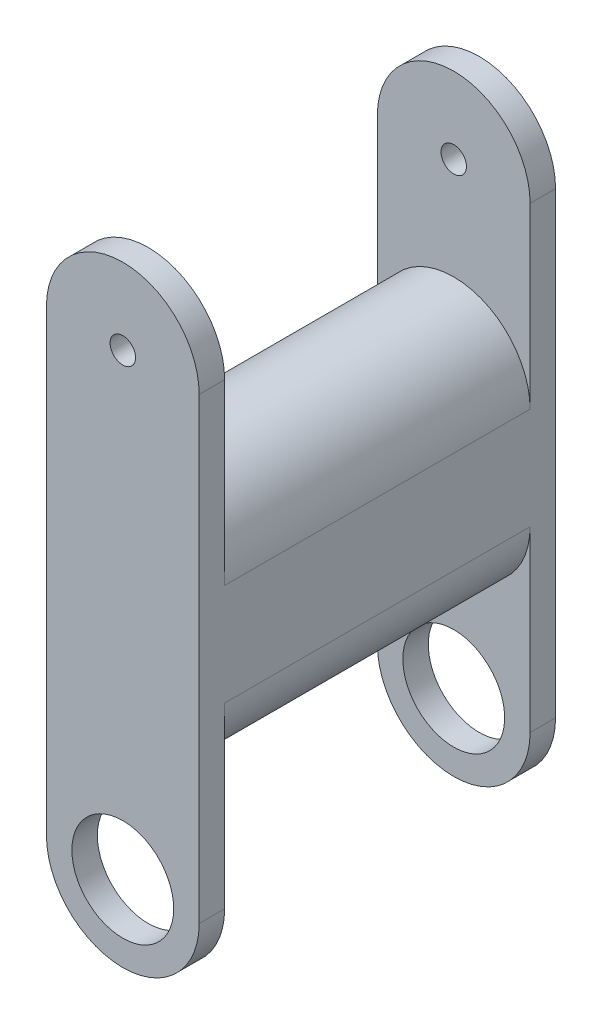
from build123d import *

# Parameters (mm, degrees)
SKETCH_1_R          = 10
SKETCH_1_R_2        = 2.5
EXTRUDE_1_DEPTH     = 70
SKETCH_2_W          = 60
SKETCH_2_H          = 40
SKETCH_2_H_2        = 50
CUT_EXTRUDE_1_DEPTH = 70
CUT_EXTRUDE_2_DEPTH = 60


with BuildPart() as part:
    # 草图1 → 凸台-拉伸1 (new body)
    with BuildSketch(Plane.XY):
        with BuildLine():
            Line((-15, 90), (-15, 0))
            ThreePointArc((-15, 0), (0, -15), (15, 0))
            Line((15, 0), (15, 90))
            ThreePointArc((15, 90), (0, 105), (-15, 90))
        make_face()
        Circle(SKETCH_1_R, mode=Mode.SUBTRACT)
        with Locations((0, 90)):
            Circle(SKETCH_1_R_2, mode=Mode.SUBTRACT)
    extrude(amount=EXTRUDE_1_DEPTH)

    # 草图2 → 切除-拉伸1 (cut)
    with BuildSketch(Plane.ZY.offset(15)):
        with Locations((35, 0)):
            Rectangle(SKETCH_2_W, SKETCH_2_H)
        with Locations((35, 95)):
            Rectangle(SKETCH_2_W, SKETCH_2_H_2)
    extrude(amount=-CUT_EXTRUDE_1_DEPTH, mode=Mode.SUBTRACT)

    # 草图3 → 切除-拉伸2 (cut)
    with BuildSketch(Plane(origin=(0, 0, 65), x_dir=(-1, 0, 0), z_dir=(0, 0, -1))):
        with BuildLine():
            Line((15, 55), (15, 70))
            Line((15, 70), (1.38e-07, 70))
            ThreePointArc((1.38e-07, 70), (10.606601767, 65.606601669), (15, 55))
        make_face()
        with BuildLine():
            ThreePointArc((-15, 55), (-10.606601669, 65.606601767), (1.38e-07, 70))
            Line((1.38e-07, 70), (-15, 70))
            Line((-15, 70), (-15, 55))
        make_face()
        with BuildLine():
            ThreePointArc((0, 20), (-10.606601718, 24.393398282), (-15, 35))
            Line((-15, 35), (-15, 20))
            Line((-15, 20), (0, 20))
        make_face()
        with BuildLine():
            ThreePointArc((15, 35), (10.606601718, 24.393398282), (0, 20))
            Line((0, 20), (15, 20))
            Line((15, 20), (15, 35))
        make_face()
    extrude(amount=CUT_EXTRUDE_2_DEPTH, mode=Mode.SUBTRACT)


solid = part.part
